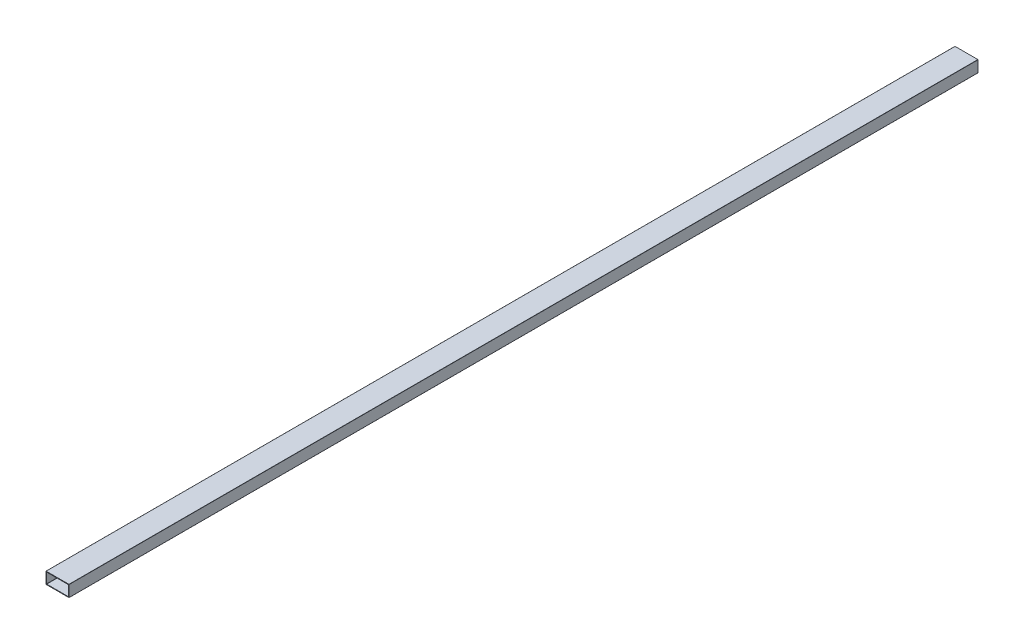
from build123d import *

# Parameters (mm, degrees)
CROQUIS1_W              = 152.4
CROQUIS1_H              = 76.2
CROQUIS1_W_2            = 144.8
CROQUIS1_H_2            = 68.6
SALIENTE_EXTRUIR1_DEPTH = 6000
REDONDEO1_R             = 1


with BuildPart() as part:
    # Croquis1 → Saliente-Extruir1 (new body)
    with BuildSketch(Plane.XY):
        Rectangle(CROQUIS1_W, CROQUIS1_H)
        Rectangle(CROQUIS1_W_2, CROQUIS1_H_2, mode=Mode.SUBTRACT)
    extrude(amount=-SALIENTE_EXTRUIR1_DEPTH)

    # Redondeo1
    redondeo1_edges = [part.edges().sort_by_distance(p)[0] for p in [
        (72.4, -34.3, -3000),
        (-72.4, -34.3, -3000),
        (-72.4, 34.3, -3000),
        (72.4, 34.3, -3000),
        (76.2, -38.1, -3000),
        (-76.2, -38.1, -3000),
        (-76.2, 38.1, -3000),
        (76.2, 38.1, -3000),
    ]]
    fillet(redondeo1_edges, radius=REDONDEO1_R)


solid = part.part
